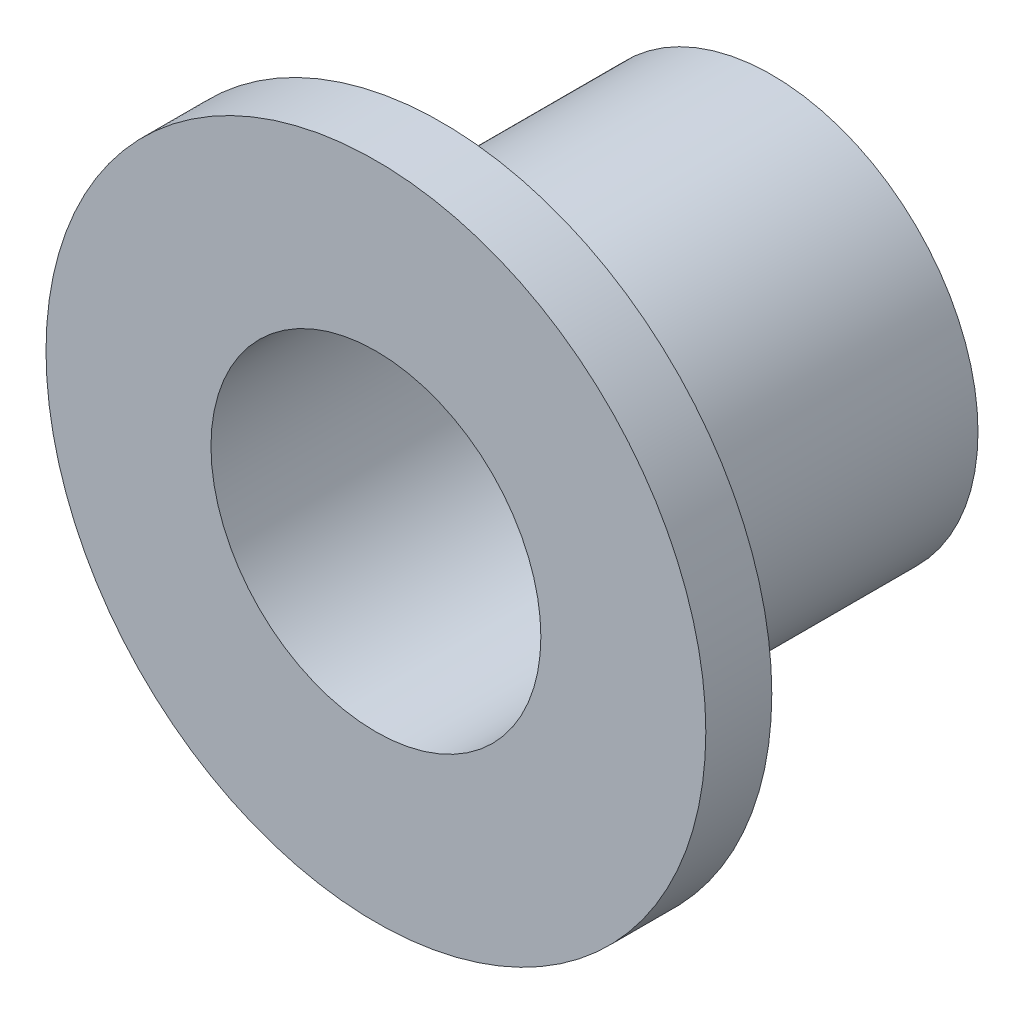
from build123d import *

# Parameters (mm, degrees)
SKETCH1_R           = 3.96875
SKETCH1_R_2         = 3.175
BOSS_EXTRUDE1_DEPTH = 6.35
SKETCH2_R           = 6.35
SKETCH2_R_2         = 3.175
BOSS_EXTRUDE2_DEPTH = 1.27


with BuildPart() as part:
    # Sketch1 → Boss-Extrude1 (new body)
    with BuildSketch(Plane.XY):
        Circle(SKETCH1_R)
        Circle(SKETCH1_R_2, mode=Mode.SUBTRACT)
    extrude(amount=BOSS_EXTRUDE1_DEPTH)

    # Sketch2 → Boss-Extrude2 (add)
    with BuildSketch(Plane.XY.offset(6.35)):
        Circle(SKETCH2_R)
        Circle(SKETCH2_R_2, mode=Mode.SUBTRACT)
    extrude(amount=BOSS_EXTRUDE2_DEPTH)


solid = part.part
